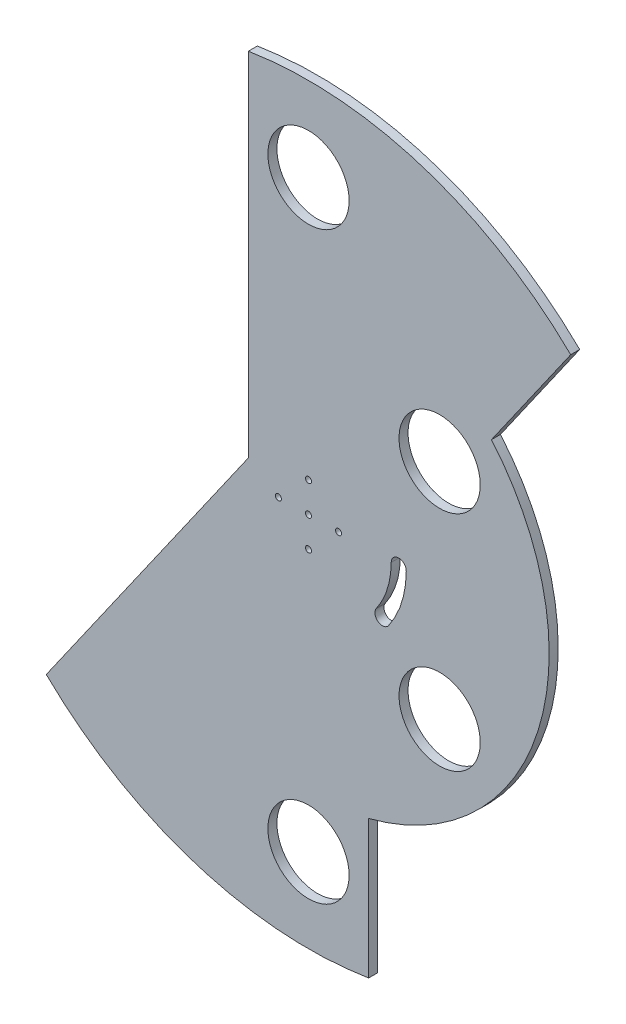
from build123d import *

# Parameters (mm, degrees)
SKETCH1_R             = 13.5
BOSS_EXTRUDE1_DEPTH   = 3
F_2_0MM_DOWEL_HOLE1_D = 2


with BuildPart() as part:
    # Sketch1 → Boss-Extrude1 (new body)
    with BuildSketch(Plane.XY):
        with BuildLine():
            Line((-20, 123.389626793), (-20, 6.305975778))
            Line((-20, 6.305975778), (-87.156423304, -89.603336304))
            ThreePointArc((-87.156423304, -89.603336304), (-37.588224938, -119.214618844), (20, -123.389626793))
            Line((20, -123.389626793), (20, -77.459666924))
            ThreePointArc((20, -77.459666924), (76.29735606, -24.05646396), (60.812080601, 51.979715784))
            Line((60.812080601, 51.979715784), (87.156423304, 89.603336304))
            ThreePointArc((87.156423304, 89.603336304), (37.588224938, 119.214618844), (-20, 123.389626793))
        make_face()
        with Locations((0, -97.082039325)):
            Circle(SKETCH1_R, mode=Mode.SUBTRACT)
        with Locations((43.59255168, -37.082039325)):
            Circle(SKETCH1_R, mode=Mode.SUBTRACT)
        with BuildLine():
            ThreePointArc((32.5, 0), (30.995800899, -9.772938484), (26.622441439, -18.641234181))
            ThreePointArc((26.622441439, -18.641234181), (23.140620238, -19.255173201), (22.526681218, -15.773352))
            ThreePointArc((22.526681218, -15.773352), (26.227216146, -8.269409486), (27.5, 0))
            ThreePointArc((27.5, 0), (30, 2.5), (32.5, 0))
        make_face(mode=Mode.SUBTRACT)
        with Locations((43.59255168, 37.082039325)):
            Circle(SKETCH1_R, mode=Mode.SUBTRACT)
        with Locations((0, 97.082039325)):
            Circle(SKETCH1_R, mode=Mode.SUBTRACT)
    extrude(amount=BOSS_EXTRUDE1_DEPTH)

    # Ø2.0mm Dowel Hole1 (through all)
    with Locations(Plane.XY.offset(3)):
        with Locations((0, -10), (10, 0), (0, 10), (0, 0), (-10, 0)):
            Hole(F_2_0MM_DOWEL_HOLE1_D / 2)


solid = part.part
